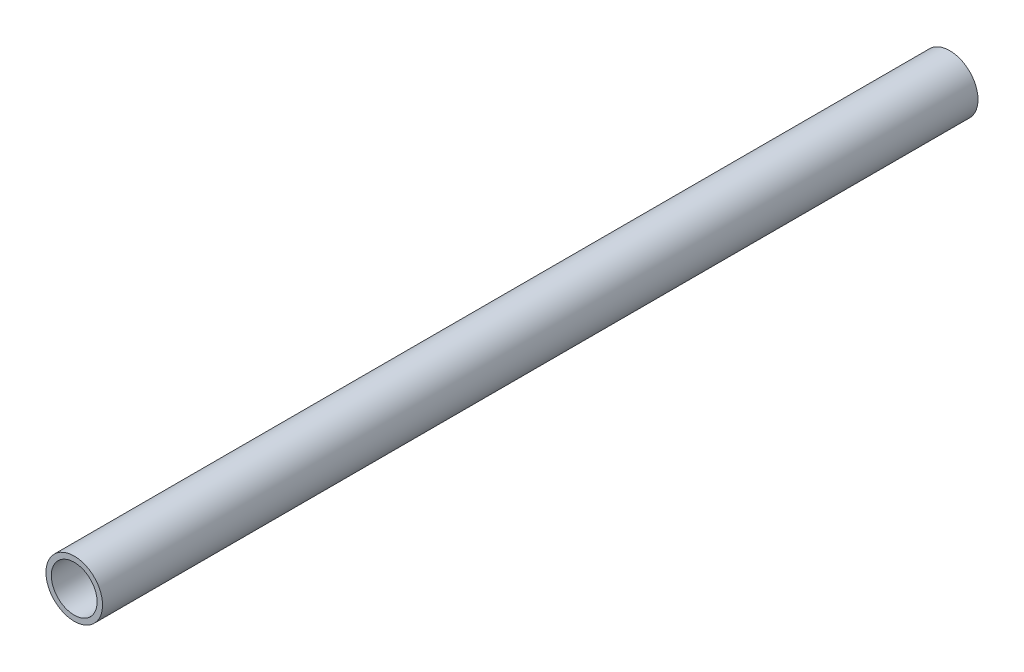
from build123d import *

# Parameters (mm, degrees)
SKETCH1_R           = 8.001
SKETCH1_R_2         = 6.477
BOSS_EXTRUDE1_DEPTH = 247.65


with BuildPart() as part:
    # Sketch1 → Boss-Extrude1 (new body)
    with BuildSketch(Plane.XY):
        Circle(SKETCH1_R)
        Circle(SKETCH1_R_2, mode=Mode.SUBTRACT)
    extrude(amount=BOSS_EXTRUDE1_DEPTH)


solid = part.part
